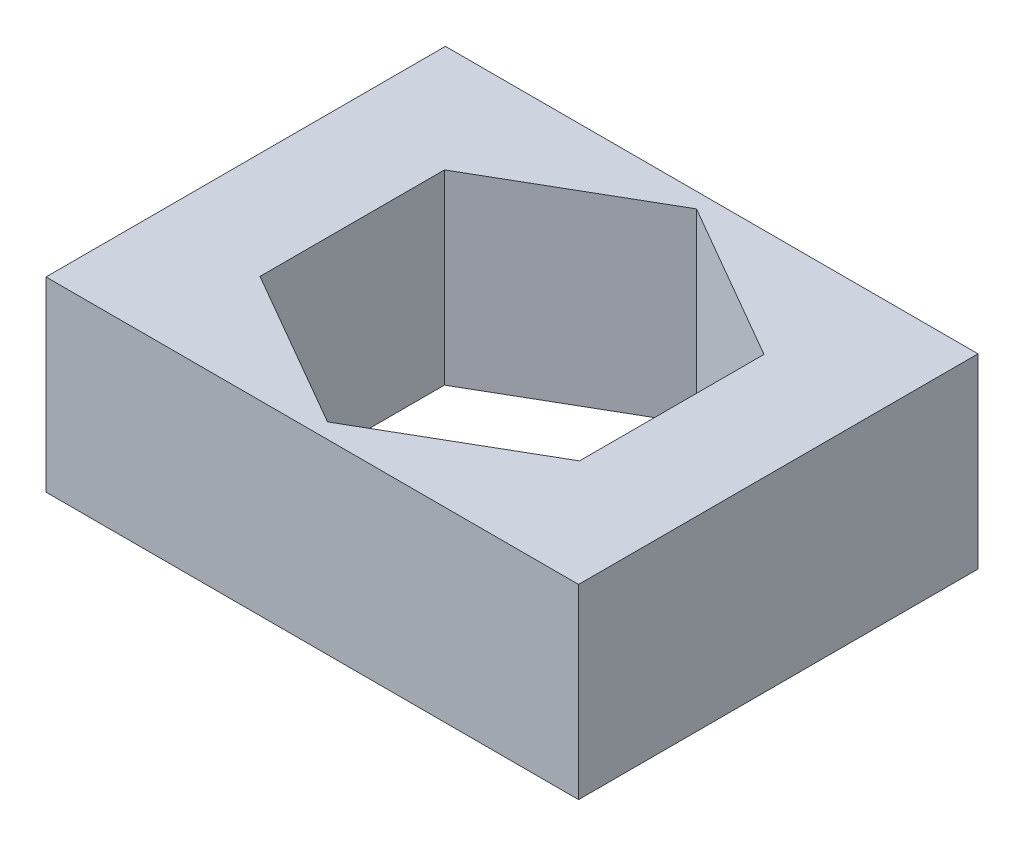
from build123d import *

# Parameters (mm, degrees)
CROQUIS1_W              = 20
CROQUIS1_H              = 15
SALIENTE_EXTRUIR1_DEPTH = 7
CORTAR_EXTRUIR4_DEPTH   = 7


with BuildPart() as part:
    # Croquis1 → Saliente-Extruir1 (new body)
    with BuildSketch(Plane(origin=(0, 0, 0), x_dir=(1, 0, 0), z_dir=(0, 1, 0))):
        Rectangle(CROQUIS1_W, CROQUIS1_H)
    extrude(amount=SALIENTE_EXTRUIR1_DEPTH)

    # Croquis8 → Cortar-Extruir4 (cut)
    with BuildSketch(Plane.XZ):
        Polygon((0, 6.92820323), (-6, 3.464101615), (-6, -3.464101615), (0, -6.92820323), (6, -3.464101615), (6, 3.464101615), align=None)
    extrude(amount=-CORTAR_EXTRUIR4_DEPTH, mode=Mode.SUBTRACT)


solid = part.part
